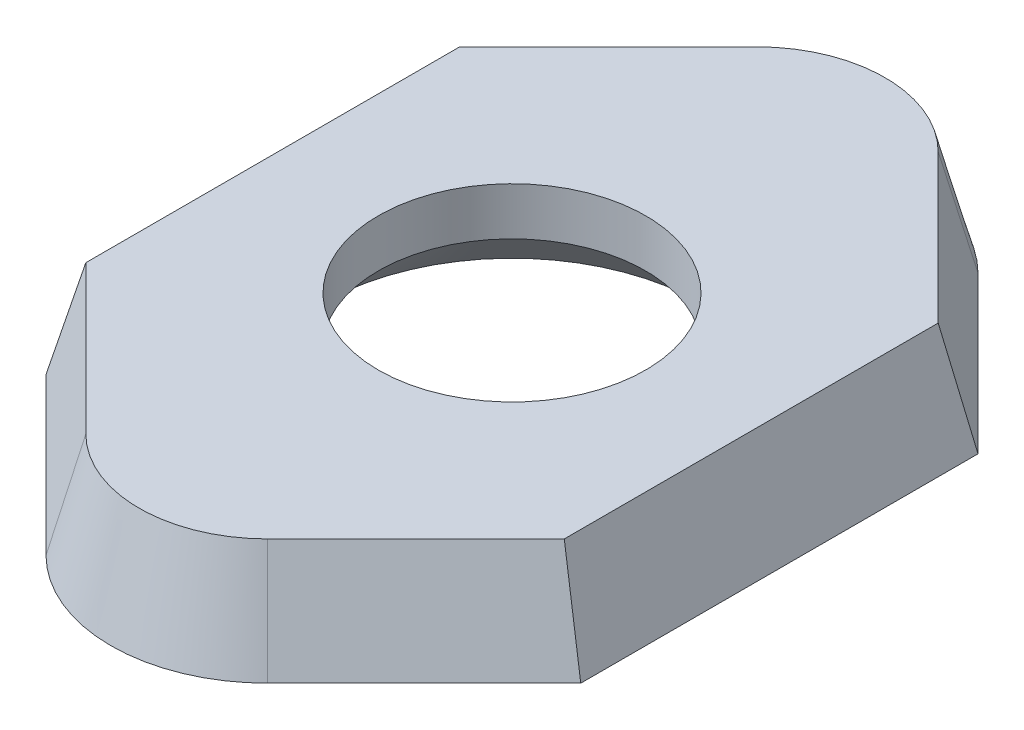
from build123d import *

# Parameters (mm, degrees)
BOSS_EXTRUDE1_DEPTH                            = 5.5
DRAFT1_ANGLE                                   = -15
BOSS_EXTRUDE3_DEPTH                            = 5.5
SKETCH11_W                                     = 36
SKETCH11_H                                     = 45
BOSS_EXTRUDE4_DEPTH                            = 7
SKETCH12_R                                     = 1.65
CUT_EXTRUDE1_DEPTH                             = 10
CSK_FOR_M4_FLAT_HEAD_MACHINE_SCREW1_AT_2_COUNT = 2
CSK_FOR_M4_FLAT_HEAD_MACHINE_SCREW1_AT_2_PITCH = 26
CSK_FOR_M4_FLAT_HEAD_MACHINE_SCREW1_AT_3_COUNT = 2
CSK_FOR_M4_FLAT_HEAD_MACHINE_SCREW1_AT_3_PITCH = 35
CSK_FOR_M4_FLAT_HEAD_MACHINE_SCREW1_AT_4_COUNT = 2
CSK_FOR_M4_FLAT_HEAD_MACHINE_SCREW1_AT_4_PITCH = 43.600458713
FILLET1_R                                      = 5
CHAMFER1_SIZE                                  = 3
CUT_EXTRUDE2_DEPTH                             = 7


with BuildPart() as part:
    # Sketch1 → Boss-Extrude1 (new body)
    with BuildSketch(Plane(origin=(0, 0, 0), x_dir=(1, 0, 0), z_dir=(0, 1, 0))):
        Polygon((-5.798989873, -18.601010127), (-14, -10.4), (-14, 10.4), (-5.798989873, 18.601010127), (5.798989873, 18.601010127), (14, 10.4), (14, -10.4), (5.798989873, -18.601010127), align=None)
    extrude(amount=BOSS_EXTRUDE1_DEPTH)

    # Draft1
    draft1_faces = [part.faces().sort_by_distance(p)[0] for p in [
        (0, 2.75, 18.601010127),
        (-9.899494937, 2.75, 14.500505063),
        (-14, 2.75, 0),
        (9.899494937, 2.75, 14.500505063),
        (-9.899494937, 2.75, -14.500505063),
        (0, 2.75, -18.601010127),
        (9.899494937, 2.75, -14.500505063),
        (14, 2.75, 0),
    ]]
    draft(draft1_faces, Plane(origin=(0, 0, 0), x_dir=(0, 0, -1), z_dir=(0, -1, 0)), DRAFT1_ANGLE)

    # Sketch10 → Boss-Extrude3 (add)
    with BuildSketch(Plane.XZ):
        with BuildLine():
            Line((-14, -10.4), (14, -10.4))
            Line((14, -10.4), (5.798989873, -18.601010127))
            ThreePointArc((5.798989873, -18.601010127), (0, -21.00303038), (-5.798989873, -18.601010127))
            Line((-5.798989873, -18.601010127), (-14, -10.4))
        make_face()
        with BuildLine():
            Line((-14, 10.4), (14, 10.4))
            Line((14, 10.4), (5.798989873, 18.601010127))
            ThreePointArc((5.798989873, 18.601010127), (0, 21.00303038), (-5.798989873, 18.601010127))
            Line((-5.798989873, 18.601010127), (-14, 10.4))
        make_face()
    extrude(amount=-BOSS_EXTRUDE3_DEPTH)

    # Cut-Sweep1: sweep along a path in Sketch9
    with BuildLine(Plane.XZ) as cut_sweep1_path:
        Line((-20.807897552, -3.592102448), (-14, -10.4))
        Line((-14, -10.4), (-5.798989873, -18.601010127))
        ThreePointArc((-5.798989873, -18.601010127), (0, -21.00303038), (5.798989873, -18.601010127))
        Line((5.798989873, -18.601010127), (14, -10.4))
        Line((14, -10.4), (20.807897552, -3.592102448))
    # Sketch7 → Cut-Sweep1 (sweep, cut)
    with BuildSketch(Plane(origin=(14, 0, -10.4), x_dir=(-0.7071067811865477, 0, 0.7071067811865474), z_dir=(-0.7071067811865474, 0, -0.7071067811865477))):
        with BuildLine():
            Line((-3.263557389, 5.754), (1.376270031, 5.754))
            ThreePointArc((1.376270031, 5.754), (1.477025905, 5.704312701), (1.498942611, 5.594129981))
            Line((1.498942611, 5.594129981), (-0.159697719, -0.596))
            Line((-0.159697719, -0.596), (-3.263557389, -0.596))
            Line((-3.263557389, -0.596), (-3.263557389, 5.754))
        make_face()
    cut_sweep1 = sweep(path=cut_sweep1_path.line, mode=Mode.SUBTRACT)

    # Mirror1: Cut-Sweep1 across plane
    add(cut_sweep1.mirror(Plane.XY), mode=Mode.SUBTRACT)

    # Sketch11 → Boss-Extrude4 (add)
    with BuildSketch(Plane(origin=(0, 5.5, 0), x_dir=(1, 0, 0), z_dir=(0, 1, 0))):
        Rectangle(SKETCH11_W, SKETCH11_H)
    extrude(amount=BOSS_EXTRUDE4_DEPTH)

    # Sketch12 → Cut-Extrude1 (cut)
    with BuildSketch(Plane.XZ.offset(-5.5)):
        with Locations(Location((-13, 17.5, 0), (0, 0, 270))):
            Circle(SKETCH12_R)
        with Locations(Location((13, 17.5, 0), (0, 0, 90))):
            Circle(SKETCH12_R)
        with Locations(Location((13, -17.5, 0), (0, 0, 270))):
            Circle(SKETCH12_R)
        with Locations(Location((-13, -17.5, 0), (0, 0, 90))):
            Circle(SKETCH12_R)
    extrude(amount=-CUT_EXTRUDE1_DEPTH, mode=Mode.SUBTRACT)

    # Sketch3 → CSK for M4 Flat Head Machine Screw1 (revolve, cut)
    with BuildSketch(Plane(origin=(13, 5.5, -17.5), x_dir=(0, 0, -1), z_dir=(1, 0, 0))):
        Polygon((0, 0), (0, 4.351936393), (2.25, 3), (2.25, 2.45), (4.7, 0), align=None)
    csk_for_m4_flat_head_machine_screw1 = revolve(axis=Axis((13, -0.85, -17.5), (0, 1, 0)), mode=Mode.SUBTRACT)

    # CSK for M4 Flat Head Machine Screw1 at 2: CSK for M4 Flat Head Machine Screw1 ×2
    with Locations(*[(-i * CSK_FOR_M4_FLAT_HEAD_MACHINE_SCREW1_AT_2_PITCH, 0, 0) for i in range(1, CSK_FOR_M4_FLAT_HEAD_MACHINE_SCREW1_AT_2_COUNT)]):
        add(csk_for_m4_flat_head_machine_screw1, mode=Mode.SUBTRACT)

    # CSK for M4 Flat Head Machine Screw1 at 3: CSK for M4 Flat Head Machine Screw1 ×2
    with Locations(*[(0, 0, i * CSK_FOR_M4_FLAT_HEAD_MACHINE_SCREW1_AT_3_PITCH) for i in range(1, CSK_FOR_M4_FLAT_HEAD_MACHINE_SCREW1_AT_3_COUNT)]):
        add(csk_for_m4_flat_head_machine_screw1, mode=Mode.SUBTRACT)

    # CSK for M4 Flat Head Machine Screw1 at 4: CSK for M4 Flat Head Machine Screw1 ×2
    with Locations(*[Vector(-0.5963240013375937, 0, 0.8027438479544529) * (i * CSK_FOR_M4_FLAT_HEAD_MACHINE_SCREW1_AT_4_PITCH) for i in range(1, CSK_FOR_M4_FLAT_HEAD_MACHINE_SCREW1_AT_4_COUNT)]):
        add(csk_for_m4_flat_head_machine_screw1, mode=Mode.SUBTRACT)

    # Fillet1
    fillet1_edges = [part.edges().sort_by_distance(p)[0] for p in [
        (18, 9, 22.5),
        (18, 9, -22.5),
        (-18, 9, -22.5),
        (-18, 9, 22.5),
    ]]
    fillet(fillet1_edges, radius=FILLET1_R)

    # Sketch13 → Cut-Revolve1 (revolve, cut)
    with BuildSketch(Plane(origin=(0, 0, 0), x_dir=(0, 0, -1), z_dir=(1, 0, 0)), mode=Mode.PRIVATE) as cut_revolve1_sk:
        Polygon((0, 14.8), (0, -4.2), (7, -4.2), (7, 2.8), (7, 21.459689624), (0, 21.459689624), align=None)
    revolve(cut_revolve1_sk.sketch.rotate(Axis((0, -5.116386004, 0), (0, 1, 0)), 180), axis=Axis((0, -5.116386004, 0), (0, 1, 0)), mode=Mode.SUBTRACT)

    # Chamfer1
    chamfer1_edges = [part.edges().sort_by_distance(p)[0] for p in [
        (0, 0, -7),
    ]]
    chamfer(chamfer1_edges, length=CHAMFER1_SIZE)

    # Sketch14 → Cut-Extrude2 (cut)
    with BuildSketch(Plane(origin=(0, 12.5, 0), x_dir=(1, 0, 0), z_dir=(0, 1, 0))):
        with BuildLine():
            Line((18, -17.5), (18, 17.5))
            ThreePointArc((18, 17.5), (16.535533906, 21.035533906), (13, 22.5))
            Line((13, 22.5), (-13, 22.5))
            ThreePointArc((-13, 22.5), (-16.535533906, 21.035533906), (-18, 17.5))
            Line((-18, 17.5), (-18, -17.5))
            ThreePointArc((-18, -17.5), (-16.535533906, -21.035533906), (-13, -22.5))
            Line((-13, -22.5), (13, -22.5))
            ThreePointArc((13, -22.5), (16.535533906, -21.035533906), (18, -17.5))
        make_face()
    extrude(amount=-CUT_EXTRUDE2_DEPTH, mode=Mode.SUBTRACT)


solid = part.part
